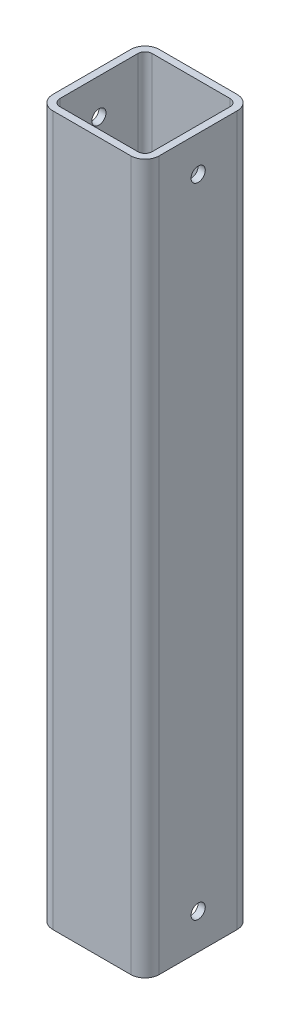
from build123d import *

# Parameters (mm, degrees)
EXTRUDE_1_DEPTH          = 100
CUT_EXTRUDE_1_DEPTH      = 103.225241501
CUT_EXTRUDE_1_DEPTH_BACK = 103.225241501
SKETCH_2_R               = 2


with BuildPart() as part:
    # 草图1 → 凸台-拉伸1 (new, symmetric)
    with BuildSketch(Plane(origin=(0, 0, 0), x_dir=(1, 0, 0), z_dir=(0, 1, 0))):
        with BuildLine():
            Line((-11, -15), (11, -15))
            ThreePointArc((11, -15), (13.828427125, -13.828427125), (15, -11))
            Line((15, -11), (15, 11))
            ThreePointArc((15, 11), (13.828427125, 13.828427125), (11, 15))
            Line((11, 15), (-11, 15))
            ThreePointArc((-11, 15), (-13.828427125, 13.828427125), (-15, 11))
            Line((-15, 11), (-15, -11))
            ThreePointArc((-15, -11), (-13.828427125, -13.828427125), (-11, -15))
        make_face()
        with BuildLine():
            Line((-11, -13), (11, -13))
            ThreePointArc((11, -13), (12.414213562, -12.414213562), (13, -11))
            Line((13, -11), (13, 11))
            ThreePointArc((13, 11), (12.414213562, 12.414213562), (11, 13))
            Line((11, 13), (-11, 13))
            ThreePointArc((-11, 13), (-12.414213562, 12.414213562), (-13, 11))
            Line((-13, 11), (-13, -11))
            ThreePointArc((-13, -11), (-12.414213562, -12.414213562), (-11, -13))
        make_face(mode=Mode.SUBTRACT)
    extrude(amount=EXTRUDE_1_DEPTH, both=True)

    # 草图2 → 切除-拉伸1 (cut, two sides: drawn at the far end of the back side and taken through both)
    with BuildSketch(Plane(origin=(0, 0, 0), x_dir=(0, 0, -1), z_dir=(1, 0, 0)).offset(-CUT_EXTRUDE_1_DEPTH_BACK)):
        with Locations((0, 90)):
            Circle(SKETCH_2_R)
        with Locations((0, -90)):
            Circle(SKETCH_2_R)
    extrude(amount=CUT_EXTRUDE_1_DEPTH + CUT_EXTRUDE_1_DEPTH_BACK, mode=Mode.SUBTRACT)


solid = part.part
